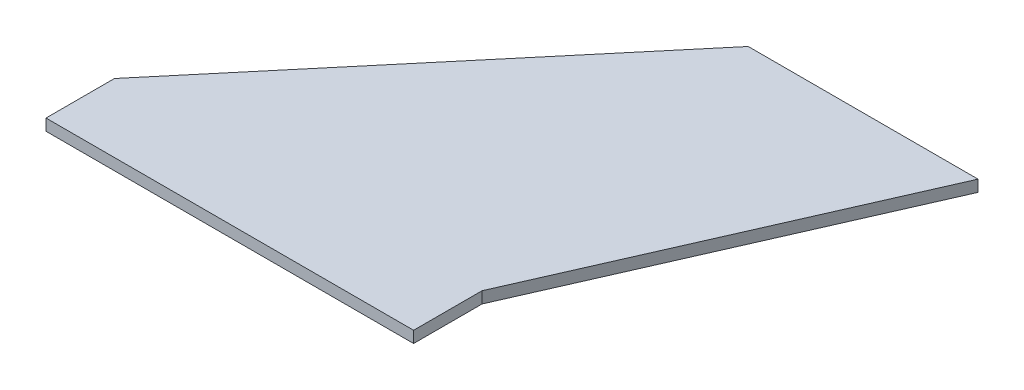
from build123d import *

# Parameters (mm, degrees)
BOSS_EXTRUDE1_DEPTH = 3.175


with BuildPart() as part:
    # Sketch1 → Boss-Extrude1 (new body)
    with BuildSketch(Plane(origin=(0, 0, 0), x_dir=(1, 0, 0), z_dir=(0, 1, 0))):
        Polygon((-50.8, 0), (29.12423987, 95.25), (92.62423987, 95.25), (50.8, 0), (50.8, -18.923), (-50.8, -18.923), align=None)
    extrude(amount=BOSS_EXTRUDE1_DEPTH)


solid = part.part
